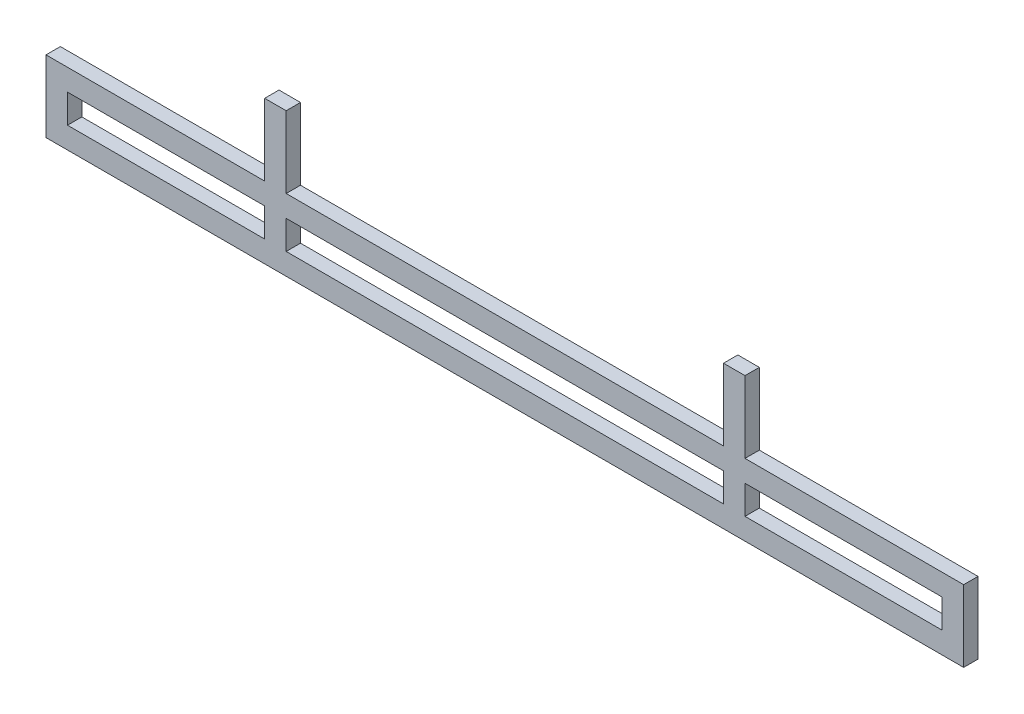
from build123d import *

# Parameters (mm, degrees)
SKETCH1_W                = 640
SKETCH1_H                = 50
BOSS_EXTRUDE1_DEPTH      = 10
SKETCH2_W                = 15
SKETCH2_H                = 50
BOSS_EXTRUDE2_DEPTH      = 10
SKETCH3_W                = 610
SKETCH3_H                = 20
CUT_EXTRUDE1_DEPTH       = 10
ESBO_O1_W                = 15
ESBO_O1_H                = 20
RESSALTO_EXTRUS_O1_DEPTH = 10


with BuildPart() as part:
    # Sketch1 → Boss-Extrude1 (new body)
    with BuildSketch(Plane.XY):
        with Locations((-320, -120.36)):
            Rectangle(SKETCH1_W, SKETCH1_H)
    extrude(amount=BOSS_EXTRUDE1_DEPTH)

    # Sketch2 → Boss-Extrude2 (add)
    with BuildSketch(Plane.XY):
        with Locations((-160, -70.36)):
            Rectangle(SKETCH2_W, SKETCH2_H)
        with Locations((-480, -70.36)):
            Rectangle(SKETCH2_W, SKETCH2_H)
    extrude(amount=BOSS_EXTRUDE2_DEPTH)

    # Sketch3 → Cut-Extrude1 (cut)
    with BuildSketch(Plane(origin=(0, 0, 0), x_dir=(-1, 0, 0), z_dir=(0, 0, -1))):
        with Locations((320, -120.36)):
            Rectangle(SKETCH3_W, SKETCH3_H)
    extrude(amount=-CUT_EXTRUDE1_DEPTH, mode=Mode.SUBTRACT)

    # Esboço1 → Ressalto-extrusão1 (add)
    with BuildSketch(Plane.XY.offset(10)):
        with Locations((-480, -120.36)):
            Rectangle(ESBO_O1_W, ESBO_O1_H)
        with Locations((-160, -120.36)):
            Rectangle(ESBO_O1_W, ESBO_O1_H)
    extrude(amount=-RESSALTO_EXTRUS_O1_DEPTH)


solid = part.part
